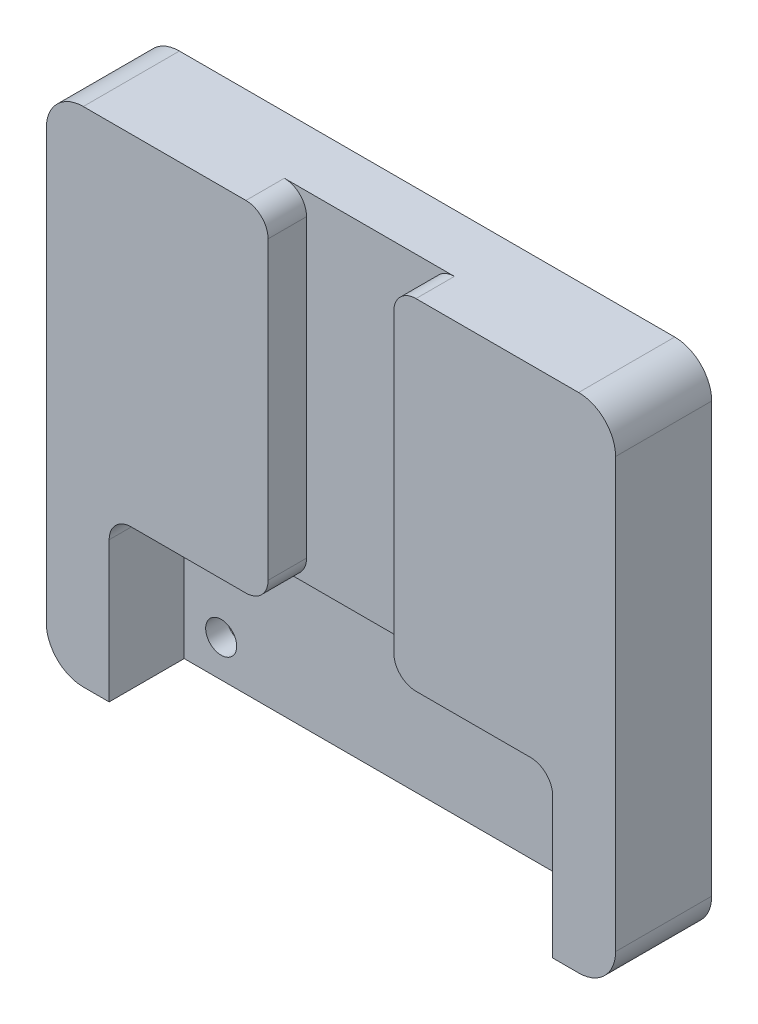
from build123d import *

# Parameters (mm, degrees)
SKETCH_1_W          = 68
SKETCH_1_H          = 13
EXTRUDE_1_DEPTH     = 77
SKETCH_2_W          = 60
SKETCH_2_H          = 22
CUT_EXTRUDE_1_DEPTH = 10.15
FILLET_1_R          = 5
SKETCH_3_W          = 17
SKETCH_3_H          = 46
CUT_EXTRUDE_2_DEPTH = 5.2
FILLET_2_R          = 3
SKETCH_5_R          = 2.1
CUT_EXTRUDE_4_DEPTH = 4.6


with BuildPart() as part:
    # 草图1 → 凸台-拉伸1 (new body)
    with BuildSketch(Plane.YZ):
        with Locations((34, 6.5)):
            Rectangle(SKETCH_1_W, SKETCH_1_H)
    extrude(amount=EXTRUDE_1_DEPTH)

    # 草图2 → 切除-拉伸1 (cut)
    with BuildSketch(Plane.XY.offset(13)):
        with Locations((38.5, 11)):
            Rectangle(SKETCH_2_W, SKETCH_2_H)
    extrude(amount=-CUT_EXTRUDE_1_DEPTH, mode=Mode.SUBTRACT)

    # 圆角1
    fillet_1_edges = [part.edges().sort_by_distance(p)[0] for p in [
        (77, 68, 6.5),
        (77, 0, 6.5),
        (0, 68, 6.5),
        (0, 0, 6.5),
    ]]
    fillet(fillet_1_edges, radius=FILLET_1_R)

    # 草图3 → 切除-拉伸2 (cut)
    with BuildSketch(Plane.XY.offset(13)):
        with Locations((38.5, 45)):
            Rectangle(SKETCH_3_W, SKETCH_3_H)
    extrude(amount=-CUT_EXTRUDE_2_DEPTH, mode=Mode.SUBTRACT)

    # 圆角2
    fillet_2_edges = [part.edges().sort_by_distance(p)[0] for p in [
        (8.5, 22, 7.925),
        (68.5, 22, 7.925),
        (30, 22, 10.4),
        (30, 68, 10.4),
        (47, 68, 10.4),
        (47, 22, 10.4),
    ]]
    fillet(fillet_2_edges, radius=FILLET_2_R)

    # 草图5 → 切除-拉伸4 (cut)
    with BuildSketch(Plane.XY.offset(2.85)):
        with Locations((63.5, 5)):
            Circle(SKETCH_5_R)
        with Locations((13.5, 5)):
            Circle(SKETCH_5_R)
        with Locations((13.5, 19)):
            Circle(SKETCH_5_R)
        with Locations((63.5, 19)):
            Circle(SKETCH_5_R)
    extrude(amount=-CUT_EXTRUDE_4_DEPTH, mode=Mode.SUBTRACT)


solid = part.part
